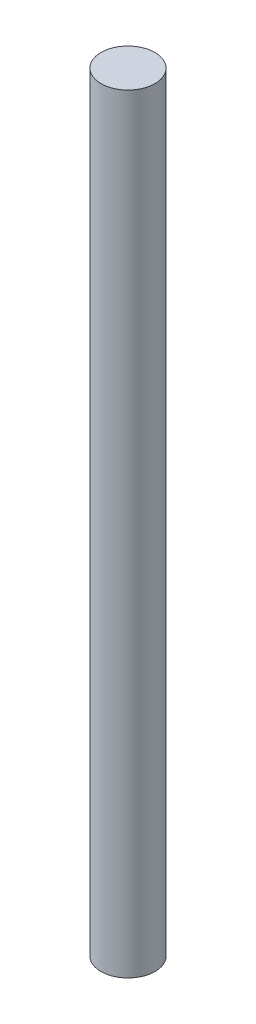
from build123d import *

# Parameters (mm, degrees)
SKETCH1_R           = 6.35
BOSS_EXTRUDE1_DEPTH = 180.975


with BuildPart() as part:
    # Sketch1 → Boss-Extrude1 (new body)
    with BuildSketch(Plane(origin=(0, 0, 0), x_dir=(1, 0, 0), z_dir=(0, 1, 0))):
        with Locations(Location((0, 0, 0), (0, 0, 270))):
            Circle(SKETCH1_R)
    extrude(amount=BOSS_EXTRUDE1_DEPTH)


solid = part.part
